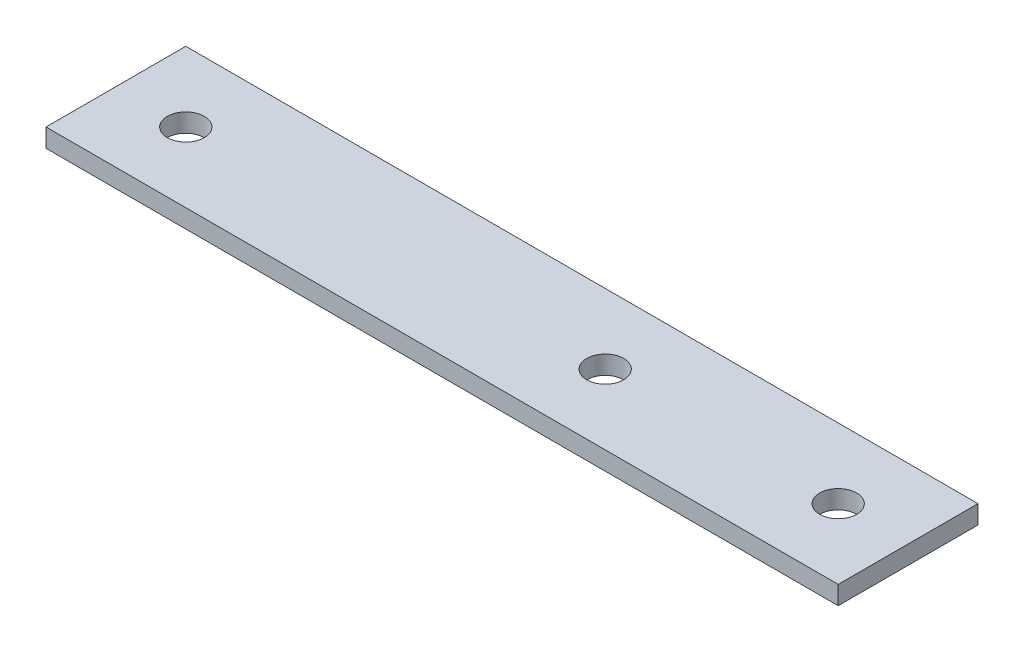
from build123d import *

# Parameters (mm, degrees)
SKETCH1_W           = 68
SKETCH1_H           = 12
SKETCH1_R           = 1.5875
BOSS_EXTRUDE1_DEPTH = 0.79375


with BuildPart() as part:
    # Sketch1 → Boss-Extrude1 (new, symmetric)
    with BuildSketch(Plane(origin=(0, 0, 0), x_dir=(1, 0, 0), z_dir=(0, 1, 0))):
        Rectangle(SKETCH1_W, SKETCH1_H)
        with Locations(Location((-28, 0, 0), (0, 0, 270))):
            Circle(SKETCH1_R, mode=Mode.SUBTRACT)
        with Locations(Location((28, 0, 0), (0, 0, 270))):
            Circle(SKETCH1_R, mode=Mode.SUBTRACT)
        with Locations(Location((8, 0, 0), (0, 0, 270))):
            Circle(SKETCH1_R, mode=Mode.SUBTRACT)
    extrude(amount=BOSS_EXTRUDE1_DEPTH, both=True)


solid = part.part
